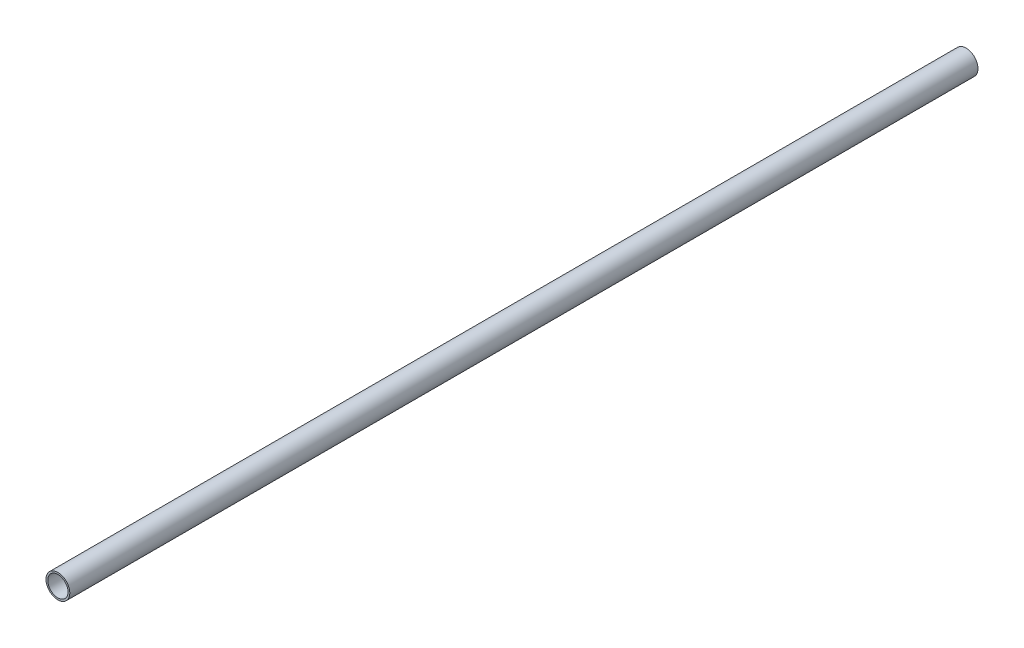
from build123d import *

# Parameters (mm, degrees)
SKETCH1_W    = 457.2
SKETCH1_H    = 0.889
SCALE1_SCALE = 0.6


with BuildPart() as part:
    # Sketch1 → Revolve1 (revolve)
    with BuildSketch(Plane(origin=(0, 0, 0), x_dir=(0, 0, -1), z_dir=(1, 0, 0)), mode=Mode.PRIVATE) as revolve1_sk:
        with Locations((0, 5.5499)):
            Rectangle(SKETCH1_W, SKETCH1_H)
    revolve(revolve1_sk.sketch.rotate(Axis((0, 0, 76.536987973), (0, 0, -1)), 90), axis=Axis((0, 0, 76.536987973), (0, 0, -1)))


with BuildPart() as part_1:
    # Scale1: scaled about (0, 0, 0)
    add(part.part.scale(SCALE1_SCALE))


solid = part_1.part
